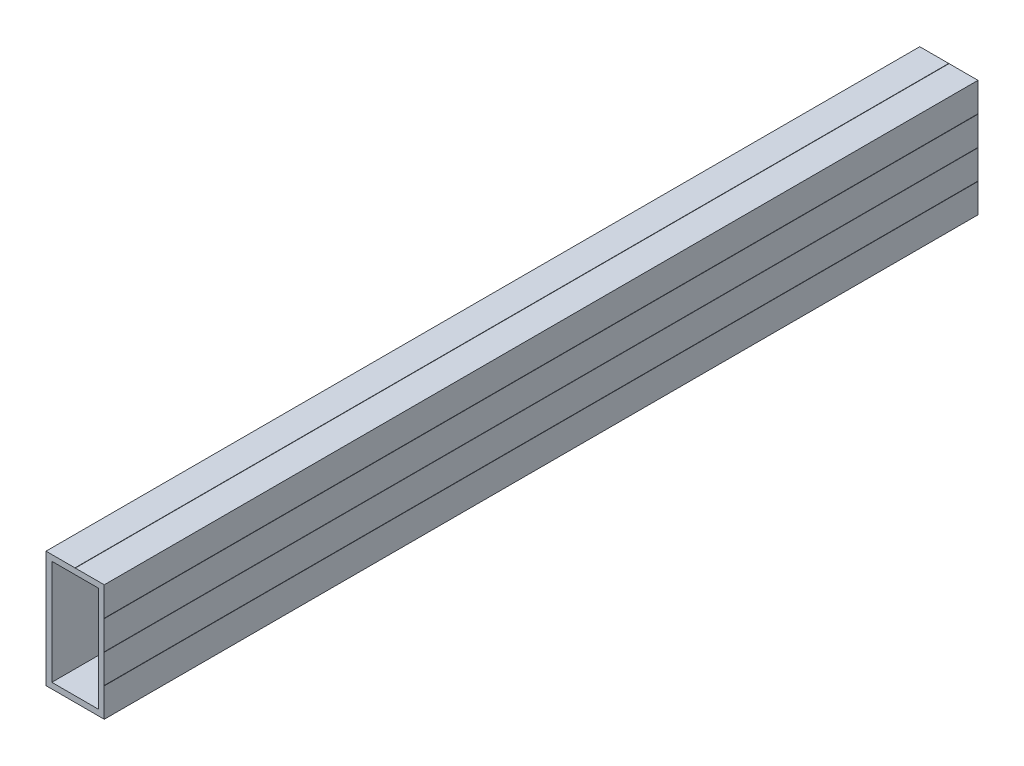
from build123d import *

# Parameters (mm, degrees)
SKETCH1_W           = 1498.6
SKETCH1_H           = 50.8
BOSS_EXTRUDE1_DEPTH = 25.4
CUT_EXTRUDE1_DEPTH  = 1498.6
CUT_EXTRUDE2_DEPTH  = 1499.869043646
CUT_EXTRUDE3_DEPTH  = 1498.6
CUT_EXTRUDE4_DEPTH  = 1498.6
CUT_EXTRUDE5_DEPTH  = 1499.869043646
CUT_EXTRUDE6_DEPTH  = 1499.869043646
CUT_EXTRUDE7_DEPTH  = 1498.6
CUT_EXTRUDE8_DEPTH  = 1498.6
SKETCH10_W          = 20.32
SKETCH10_H          = 45.72
CUT_EXTRUDE9_DEPTH  = 1499.869043646
DRAFT1_ANGLE        = 45
DRAFT2_ANGLE        = 45.000000005
DRAFT3_ANGLE        = 45
DRAFT4_ANGLE        = 45
DRAFT5_ANGLE        = 45
DRAFT6_ANGLE        = 44.999999995
SKETCH11_W          = 61.962293059
SKETCH11_H          = 88.678950317
CUT_EXTRUDE10_DEPTH = 1117.6


with BuildPart() as part:
    # Sketch1 → Boss-Extrude1 (new body)
    with BuildSketch(Plane(origin=(12.7, 0, 0), x_dir=(0, 0, -1), z_dir=(1, 0, 0))):
        Rectangle(SKETCH1_W, SKETCH1_H)
    extrude(amount=-BOSS_EXTRUDE1_DEPTH)

    # Sketch2 → Cut-Extrude1 (cut)
    with BuildSketch(Plane.XY.offset(749.3)):
        Polygon((0.0762, 25.4), (-0.0762, 25.4), (0.0762, 25.2476), align=None)
    extrude(amount=-CUT_EXTRUDE1_DEPTH, mode=Mode.SUBTRACT)

    # Sketch3 → Cut-Extrude2 (cut, through all)
    with BuildSketch(Plane.XY.offset(749.3)):
        Polygon((12.7, 12.6238), (12.7, 12.7762), (12.5476, 12.7762), align=None)
    extrude(amount=-CUT_EXTRUDE2_DEPTH, mode=Mode.SUBTRACT)

    # Sketch4 → Cut-Extrude3 (cut)
    with BuildSketch(Plane.XY.offset(749.3)):
        Polygon((12.7, -0.0762), (12.7, 0.0762), (12.5476, -0.0762), align=None)
    extrude(amount=-CUT_EXTRUDE3_DEPTH, mode=Mode.SUBTRACT)

    # Sketch5 → Cut-Extrude4 (cut)
    with BuildSketch(Plane.XY.offset(749.3)):
        Polygon((12.7, -12.7762), (12.7, -12.6238), (12.5476, -12.6238), align=None)
    extrude(amount=-CUT_EXTRUDE4_DEPTH, mode=Mode.SUBTRACT)

    # Sketch6 → Cut-Extrude5 (cut, through all)
    with BuildSketch(Plane.XY.offset(749.3)):
        Polygon((0.0762, -25.4), (-0.0762, -25.2476), (-0.0762, -25.4), align=None)
    extrude(amount=-CUT_EXTRUDE5_DEPTH, mode=Mode.SUBTRACT)

    # Sketch7 → Cut-Extrude6 (cut, through all)
    with BuildSketch(Plane.XY.offset(749.3)):
        Polygon((-12.7, -12.6238), (-12.7, -12.7762), (-12.5476, -12.7762), align=None)
    extrude(amount=-CUT_EXTRUDE6_DEPTH, mode=Mode.SUBTRACT)

    # Sketch8 → Cut-Extrude7 (cut)
    with BuildSketch(Plane.XY.offset(749.3)):
        Polygon((-12.7, 0.0762), (-12.7, -0.0762), (-12.5476, 0.0762), align=None)
    extrude(amount=-CUT_EXTRUDE7_DEPTH, mode=Mode.SUBTRACT)

    # Sketch9 → Cut-Extrude8 (cut)
    with BuildSketch(Plane.XY.offset(749.3)):
        Polygon((-12.7, 12.7762), (-12.7, 12.6238), (-12.5476, 12.6238), align=None)
    extrude(amount=-CUT_EXTRUDE8_DEPTH, mode=Mode.SUBTRACT)

    # Sketch10 → Cut-Extrude9 (cut, through all)
    with BuildSketch(Plane.XY.offset(749.3)):
        Rectangle(SKETCH10_W, SKETCH10_H)
    extrude(amount=-CUT_EXTRUDE9_DEPTH, mode=Mode.SUBTRACT)

    # Draft1
    draft1_faces = [part.faces().sort_by_distance(p)[0] for p in [
        (0.0762, 25.3238, 0),
    ]]
    draft(draft1_faces, Plane(origin=(-12.7, 25.4, -749.3), x_dir=(0, 0, 1), z_dir=(0, 1, 0)), DRAFT1_ANGLE)

    # Draft2
    draft2_faces = [part.faces().sort_by_distance(p)[0] for p in [
        (12.6238, 12.7762, 0),
    ]]
    draft(draft2_faces, Plane(origin=(12.7, 0, 0), x_dir=(0, 0, 1), z_dir=(1, 0, 0)), DRAFT2_ANGLE)

    # Draft3
    draft3_faces = [part.faces().sort_by_distance(p)[0] for p in [
        (-0.0762, -25.3238, 0),
    ]]
    draft(draft3_faces, Plane(origin=(-12.7, -25.4, 749.3), x_dir=(0, 0, -1), z_dir=(0, -1, 0)), DRAFT3_ANGLE)

    # Draft4
    draft4_faces = [part.faces().sort_by_distance(p)[0] for p in [
        (-12.6238, -12.7762, 0),
    ]]
    draft(draft4_faces, Plane(origin=(-12.7, 0, 0), x_dir=(0, 0, -1), z_dir=(-1, 0, 0)), DRAFT4_ANGLE)

    # Draft5
    draft5_faces = [part.faces().sort_by_distance(p)[0] for p in [
        (12.6238, -12.6238, 0),
        (12.6238, 0, 0),
    ]]
    draft(draft5_faces, Plane(origin=(12.7, 0, 0), x_dir=(0, 0, 1), z_dir=(1, 0, 0)), DRAFT5_ANGLE)

    # Draft6
    draft6_faces = [part.faces().sort_by_distance(p)[0] for p in [
        (-12.6238, 0, 0),
        (-12.6238, 12.6238, 0),
    ]]
    draft(draft6_faces, Plane(origin=(-12.7, 0, 0), x_dir=(0, 0, -1), z_dir=(-1, 0, 0)), DRAFT6_ANGLE)

    # Sketch11 → Cut-Extrude10 (cut)
    with BuildSketch(Plane(origin=(0, 0, -749.3), x_dir=(-1, 0, 0), z_dir=(0, 0, -1))):
        with Locations((-2.92473676, 0.325700182)):
            Rectangle(SKETCH11_W, SKETCH11_H)
    extrude(amount=-CUT_EXTRUDE10_DEPTH, mode=Mode.SUBTRACT)


solid = part.part
